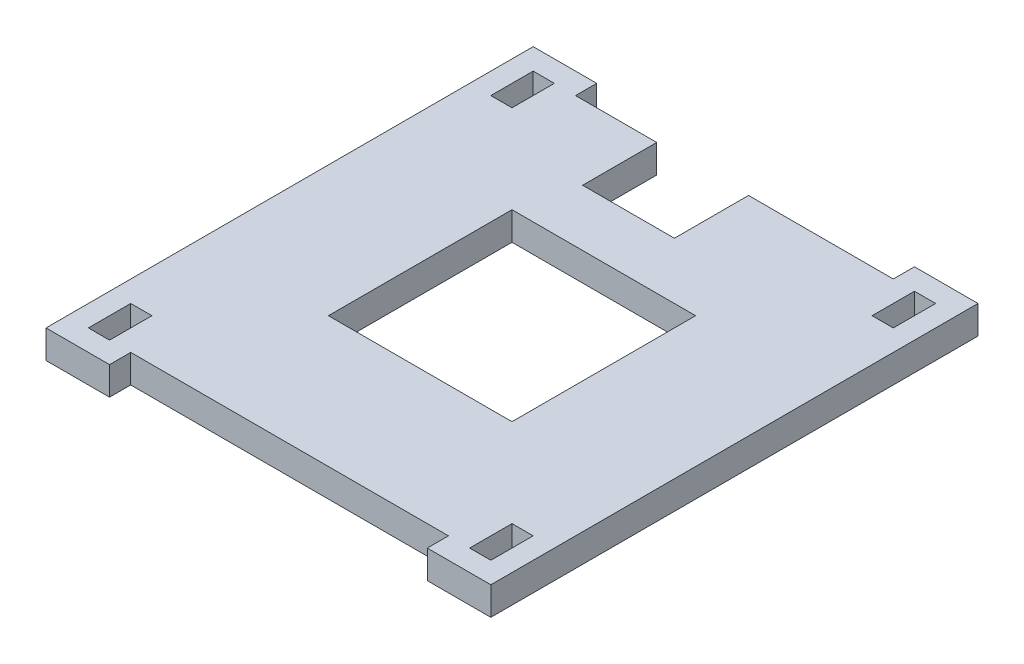
from build123d import *

# Parameters (mm, degrees)
SKETCH1_W           = 63
SKETCH1_H           = 63
BOSS_EXTRUDE1_DEPTH = 4
SKETCH2_W           = 3
SKETCH2_H           = 6
CUT_EXTRUDE1_DEPTH  = 4
SKETCH3_W           = 9
SKETCH3_H           = 4
BOSS_EXTRUDE2_DEPTH = 3
SKETCH4_W           = 9
SKETCH4_H           = 4
BOSS_EXTRUDE3_DEPTH = 3
SKETCH5_W           = 26
SKETCH5_H           = 26
CUT_EXTRUDE2_DEPTH  = 4
SKETCH6_W           = 13
SKETCH6_H           = 10.5
CUT_EXTRUDE3_DEPTH  = 4
SKETCH8_W           = 6.5
SKETCH8_H           = 6
CUT_EXTRUDE4_DEPTH  = 1.5


with BuildPart() as part:
    # Sketch1 → Boss-Extrude1 (new body)
    with BuildSketch(Plane(origin=(0, 0, 0), x_dir=(1, 0, 0), z_dir=(0, 1, 0))):
        with Locations((31.5, 31.5)):
            Rectangle(SKETCH1_W, SKETCH1_H)
    extrude(amount=BOSS_EXTRUDE1_DEPTH)

    # Sketch2 → Cut-Extrude1 (cut)
    with BuildSketch(Plane(origin=(0, 4, 0), x_dir=(1, 0, 0), z_dir=(0, 1, 0))):
        with Locations((4.5, 3)):
            Rectangle(SKETCH2_W, SKETCH2_H)
        with Locations((58.5, 3)):
            Rectangle(SKETCH2_W, SKETCH2_H)
        with Locations((58.5, 60)):
            Rectangle(SKETCH2_W, SKETCH2_H)
        with Locations((4.5, 60)):
            Rectangle(SKETCH2_W, SKETCH2_H)
    extrude(amount=-CUT_EXTRUDE1_DEPTH, mode=Mode.SUBTRACT)

    # Sketch3 → Boss-Extrude2 (add)
    with BuildSketch(Plane.XY):
        with Locations((4.5, 2)):
            Rectangle(SKETCH3_W, SKETCH3_H)
        with Locations((58.5, 2)):
            Rectangle(SKETCH3_W, SKETCH3_H)
    extrude(amount=BOSS_EXTRUDE2_DEPTH)

    # Sketch4 → Boss-Extrude3 (add)
    with BuildSketch(Plane(origin=(0, 0, -63), x_dir=(-1, 0, 0), z_dir=(0, 0, -1))):
        with Locations((-4.5, 2)):
            Rectangle(SKETCH4_W, SKETCH4_H)
        with Locations((-58.5, 2)):
            Rectangle(SKETCH4_W, SKETCH4_H)
    extrude(amount=BOSS_EXTRUDE3_DEPTH)

    # Sketch5 → Cut-Extrude2 (cut)
    with BuildSketch(Plane(origin=(0, 4, 0), x_dir=(1, 0, 0), z_dir=(0, 1, 0))):
        with Locations((31.5, 31.5)):
            Rectangle(SKETCH5_W, SKETCH5_H)
    extrude(amount=-CUT_EXTRUDE2_DEPTH, mode=Mode.SUBTRACT)

    # Sketch6 → Cut-Extrude3 (cut)
    with BuildSketch(Plane(origin=(0, 4, 0), x_dir=(1, 0, 0), z_dir=(0, 1, 0))):
        with Locations((27, 57.75)):
            Rectangle(SKETCH6_W, SKETCH6_H)
    extrude(amount=-CUT_EXTRUDE3_DEPTH, mode=Mode.SUBTRACT)

    # Sketch8 → Cut-Extrude4 (cut)
    with BuildSketch(Plane.XZ):
        with Locations((41.032593784, -10)):
            Rectangle(SKETCH8_W, SKETCH8_H)
    extrude(amount=-CUT_EXTRUDE4_DEPTH, mode=Mode.SUBTRACT)


solid = part.part
